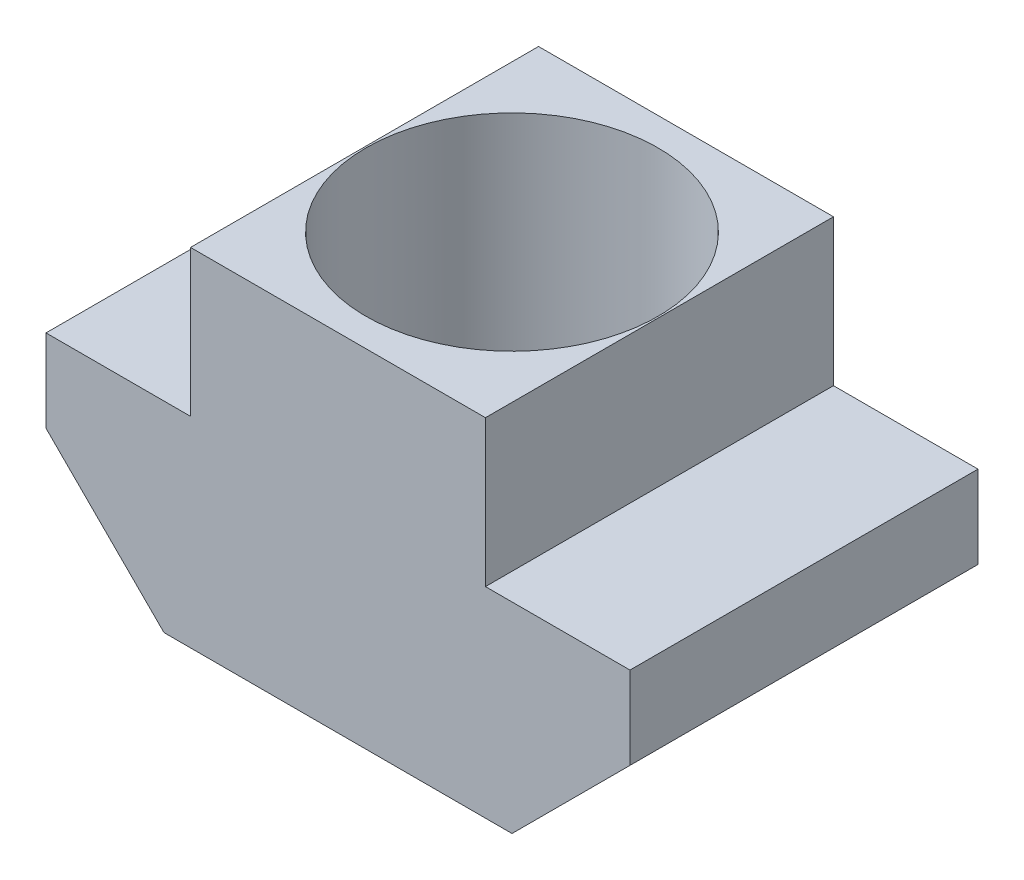
from build123d import *

# Parameters (mm, degrees)
BOSS_EXTRUDE1_DEPTH = 5.9
SKETCH2_R           = 2.475
CUT_EXTRUDE7_DEPTH  = 10.689525272


with BuildPart() as part:
    # Sketch1 → Boss-Extrude1 (new body)
    with BuildSketch(Plane.XY):
        Polygon((4.95, 0.3), (2.95, -1.7), (-2.95, -1.7), (-4.95, 0.3), (-4.95, 1.7), (-2.5, 1.7), (-2.5, 4.18), (2.5, 4.18), (2.5, 1.7), (4.95, 1.7), align=None)
    extrude(amount=BOSS_EXTRUDE1_DEPTH)

    # Sketch2 → Cut-Extrude7 (cut, through all)
    with BuildSketch(Plane(origin=(0, 4.18, 0), x_dir=(1, 0, 0), z_dir=(0, 1, 0))):
        with Locations(Location((0, -2.95, 0), (0, 0, 180))):
            Circle(SKETCH2_R)
    extrude(amount=-CUT_EXTRUDE7_DEPTH, mode=Mode.SUBTRACT)


solid = part.part
